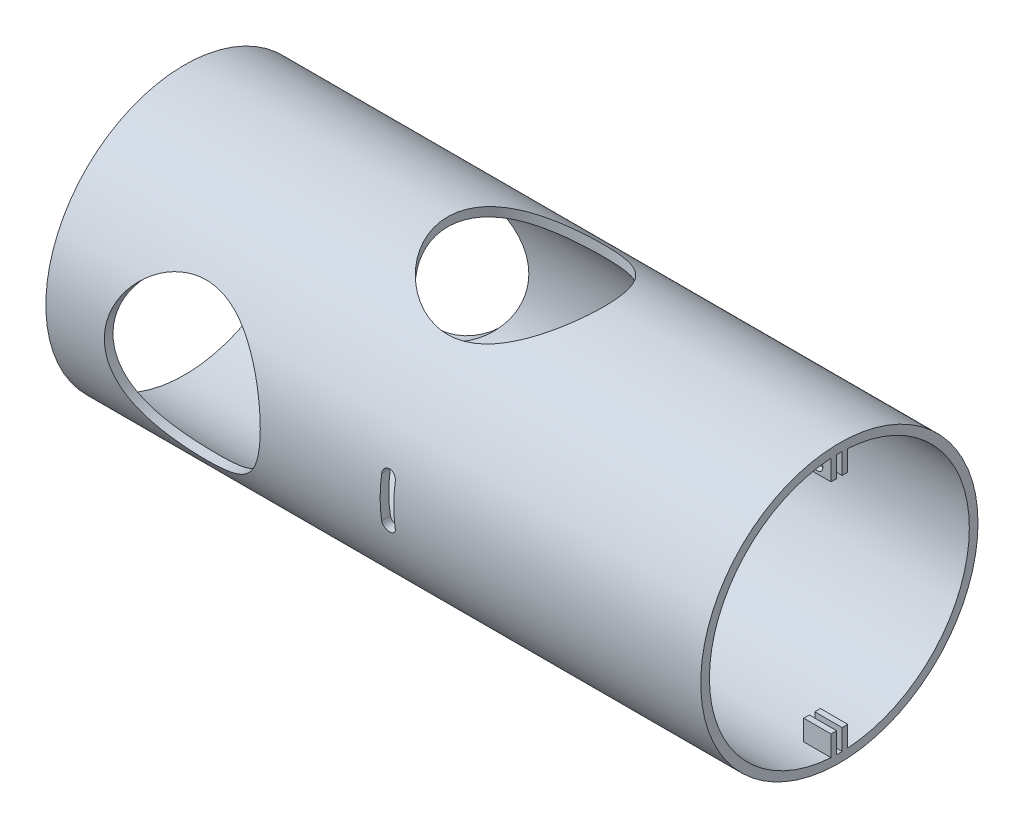
from build123d import *

# Parameters (mm, degrees)
SKETCH1_W               = 480
SKETCH1_H               = 6.35
CUT_EXTRUDE1_DEPTH      = 502.044030001
CUT_EXTRUDE1_DEPTH_BACK = 502.044030001
SKETCH2_R               = 57.15
CUT_EXTRUDE2_DEPTH      = 502.044030138
CUT_EXTRUDE2_DEPTH_BACK = 502.044030138
SKETCH3_R               = 57.15
BOSS_EXTRUDE1_DEPTH     = 20
CUT_EXTRUDE3_DEPTH      = 20
CUT_EXTRUDE3_DEPTH_BACK = 20
SKETCH5_R               = 4
CUT_EXTRUDE4_DEPTH      = 502.044030138
CUT_EXTRUDE4_DEPTH_BACK = 502.044030138


with BuildPart() as part:
    # Sketch1 → Revolve1 (revolve)
    with BuildSketch(Plane(origin=(0, 0, 0), x_dir=(1, 0, 0), z_dir=(0, 1, 0))):
        with Locations((-240, 98.425)):
            Rectangle(SKETCH1_W, SKETCH1_H)
    revolve(axis=Axis((-72.379489937, 0, 0), (-1, 0, 0)))

    # Sketch2 → Cut-Extrude1 (cut, two sides: drawn at the far end of the back side and taken through both)
    with BuildSketch(Plane.XY.offset(-CUT_EXTRUDE1_DEPTH_BACK)):
        with Locations((-380, 0)):
            Circle(SKETCH2_R)
    extrude(amount=CUT_EXTRUDE1_DEPTH + CUT_EXTRUDE1_DEPTH_BACK, mode=Mode.SUBTRACT)

    # Sketch3 → Cut-Extrude2 (cut, two sides: drawn at the far end of the back side and taken through both)
    with BuildSketch(Plane(origin=(0, 0, 0), x_dir=(1, 0, 0), z_dir=(0, 1, 0)).offset(-CUT_EXTRUDE2_DEPTH_BACK)):
        with Locations(Location((-230, 0, 0), (0, 0, 270))):
            Circle(SKETCH3_R)
    extrude(amount=CUT_EXTRUDE2_DEPTH + CUT_EXTRUDE2_DEPTH_BACK, mode=Mode.SUBTRACT)

    # Sketch4 → Boss-Extrude1 (add)
    with BuildSketch(Plane(origin=(0, 0, 0), x_dir=(0, 0, -1), z_dir=(1, 0, 0))):
        Polygon((-2, 96.063267686), (-2, 79.997659982), (-6.119515817, 79.997659982), (-6.119515817, 98.397659982), (6.119515817, 98.397659982), (6.119515817, 80), (2, 80), (2, 96.063267686), align=None)
    boss_extrude1 = extrude(amount=-BOSS_EXTRUDE1_DEPTH)

    # Mirror1: Boss-Extrude1 across plane
    add(boss_extrude1.mirror(Plane.ZX))

    # Sketch5 → Cut-Extrude3 (cut, two sides: drawn at the far end of the back side and taken through both)
    with BuildSketch(Plane.XY.offset(-CUT_EXTRUDE3_DEPTH_BACK)):
        with Locations(Location((-10, 86, 0), (0, 0, 90))):
            Circle(SKETCH5_R)
    extrude(amount=CUT_EXTRUDE3_DEPTH + CUT_EXTRUDE3_DEPTH_BACK, mode=Mode.SUBTRACT)

    # Sketch6 → Cut-Extrude4 (cut, two sides: drawn at the far end of the back side and taken through both)
    with BuildSketch(Plane.XY.offset(-CUT_EXTRUDE4_DEPTH_BACK)):
        with BuildLine():
            Line((-235, -15), (-235, 15))
            ThreePointArc((-235, 15), (-230, 20), (-225, 15))
            Line((-225, 15), (-225, -15))
            ThreePointArc((-225, -15), (-230, -20), (-235, -15))
        make_face()
    extrude(amount=CUT_EXTRUDE4_DEPTH + CUT_EXTRUDE4_DEPTH_BACK, mode=Mode.SUBTRACT)


solid = part.part
